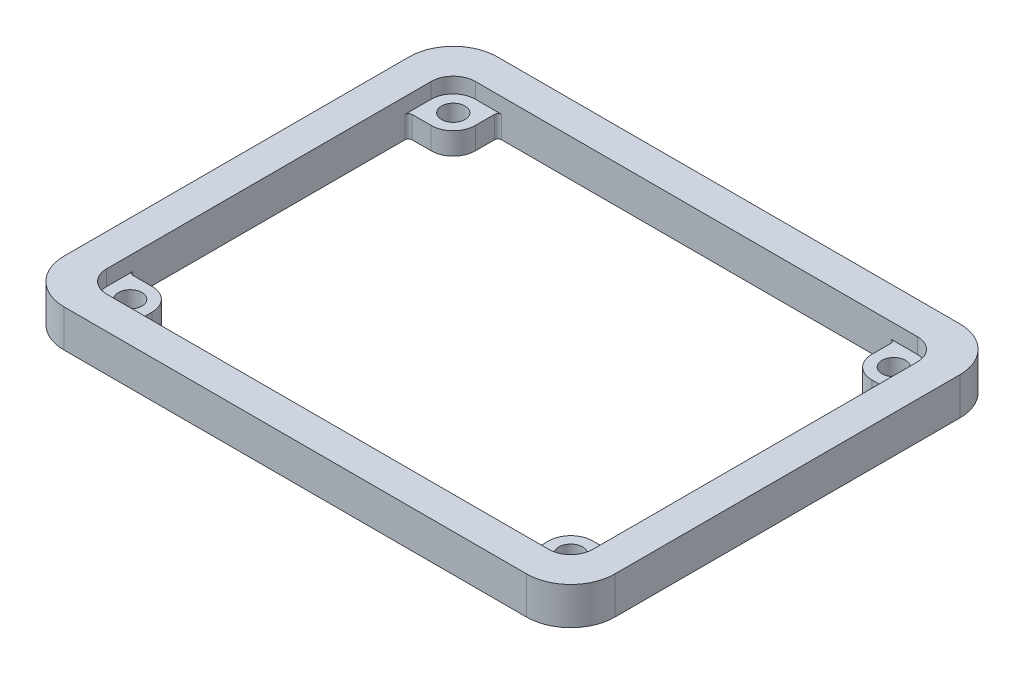
from build123d import *

# Parameters (mm, degrees)
SKETCH1_R           = 1.6
BOSS_EXTRUDE1_DEPTH = 3
BOSS_EXTRUDE2_DEPTH = 2.1


with BuildPart() as part:
    # Sketch1 → Boss-Extrude1 (new body)
    with BuildSketch(Plane(origin=(0, 0, 0), x_dir=(1, 0, 0), z_dir=(0, 1, 0))):
        with BuildLine():
            Line((-31.5, -29.5), (31.5, -29.5))
            ThreePointArc((31.5, -29.5), (35.742640687, -27.742640687), (37.5, -23.5))
            Line((37.5, -23.5), (37.5, 23.5))
            ThreePointArc((37.5, 23.5), (35.742640687, 27.742640687), (31.5, 29.5))
            Line((31.5, 29.5), (-31.5, 29.5))
            ThreePointArc((-31.5, 29.5), (-35.742640687, 27.742640687), (-37.5, 23.5))
            Line((-37.5, 23.5), (-37.5, -23.5))
            ThreePointArc((-37.5, -23.5), (-35.742640687, -27.742640687), (-31.5, -29.5))
        make_face()
        with Locations(Location((-30, 22, 0), (0, 0, 270))):
            Circle(SKETCH1_R, mode=Mode.SUBTRACT)
        with Locations(Location((30, 22, 0), (0, 0, 270))):
            Circle(SKETCH1_R, mode=Mode.SUBTRACT)
        with Locations(Location((30, -22, 0), (0, 0, 270))):
            Circle(SKETCH1_R, mode=Mode.SUBTRACT)
        with Locations(Location((-30, -22, 0), (0, 0, 270))):
            Circle(SKETCH1_R, mode=Mode.SUBTRACT)
        with BuildLine():
            Line((-27, -22), (-27, -24.6))
            ThreePointArc((-27, -24.6), (-26.853553391, -24.953553391), (-26.5, -25.1))
            Line((-26.5, -25.1), (26.5, -25.1))
            ThreePointArc((26.5, -25.1), (26.853553391, -24.953553391), (27, -24.6))
            Line((27, -24.6), (27, -22))
            ThreePointArc((27, -22), (27.878679656, -19.878679656), (30, -19))
            Line((30, -19), (32.6, -19))
            ThreePointArc((32.6, -19), (32.953553391, -18.853553391), (33.1, -18.5))
            Line((33.1, -18.5), (33.1, 18.5))
            ThreePointArc((33.1, 18.5), (32.953553391, 18.853553391), (32.6, 19))
            Line((32.6, 19), (30, 19))
            ThreePointArc((30, 19), (27.878679656, 19.878679656), (27, 22))
            Line((27, 22), (27, 24.6))
            ThreePointArc((27, 24.6), (26.853553391, 24.953553391), (26.5, 25.1))
            Line((26.5, 25.1), (-26.5, 25.1))
            ThreePointArc((-26.5, 25.1), (-26.853553391, 24.953553391), (-27, 24.6))
            Line((-27, 24.6), (-27, 22))
            ThreePointArc((-27, 22), (-27.878679656, 19.878679656), (-30, 19))
            Line((-30, 19), (-32.6, 19))
            ThreePointArc((-32.6, 19), (-32.953553391, 18.853553391), (-33.1, 18.5))
            Line((-33.1, 18.5), (-33.1, -18.5))
            ThreePointArc((-33.1, -18.5), (-32.953553391, -18.853553391), (-32.6, -19))
            Line((-32.6, -19), (-30, -19))
            ThreePointArc((-30, -19), (-27.878679656, -19.878679656), (-27, -22))
        make_face(mode=Mode.SUBTRACT)
    extrude(amount=BOSS_EXTRUDE1_DEPTH)

    # Sketch2 → Boss-Extrude2 (add)
    with BuildSketch(Plane(origin=(0, 3, 0), x_dir=(1, 0, 0), z_dir=(0, 1, 0))):
        with BuildLine():
            Line((-31.5, -29.5), (31.5, -29.5))
            ThreePointArc((31.5, -29.5), (35.742640687, -27.742640687), (37.5, -23.5))
            Line((37.5, -23.5), (37.5, 23.5))
            ThreePointArc((37.5, 23.5), (35.742640687, 27.742640687), (31.5, 29.5))
            Line((31.5, 29.5), (-31.5, 29.5))
            ThreePointArc((-31.5, 29.5), (-35.742640687, 27.742640687), (-37.5, 23.5))
            Line((-37.5, 23.5), (-37.5, -23.5))
            ThreePointArc((-37.5, -23.5), (-35.742640687, -27.742640687), (-31.5, -29.5))
        make_face()
        with BuildLine():
            Line((-30.1, -25.1), (30.1, -25.1))
            ThreePointArc((30.1, -25.1), (32.221320344, -24.221320344), (33.1, -22.1))
            Line((33.1, -22.1), (33.1, 22.1))
            ThreePointArc((33.1, 22.1), (32.221320344, 24.221320344), (30.1, 25.1))
            Line((30.1, 25.1), (-30.1, 25.1))
            ThreePointArc((-30.1, 25.1), (-32.221320344, 24.221320344), (-33.1, 22.1))
            Line((-33.1, 22.1), (-33.1, -22.1))
            ThreePointArc((-33.1, -22.1), (-32.221320344, -24.221320344), (-30.1, -25.1))
        make_face(mode=Mode.SUBTRACT)
    extrude(amount=BOSS_EXTRUDE2_DEPTH)


solid = part.part
